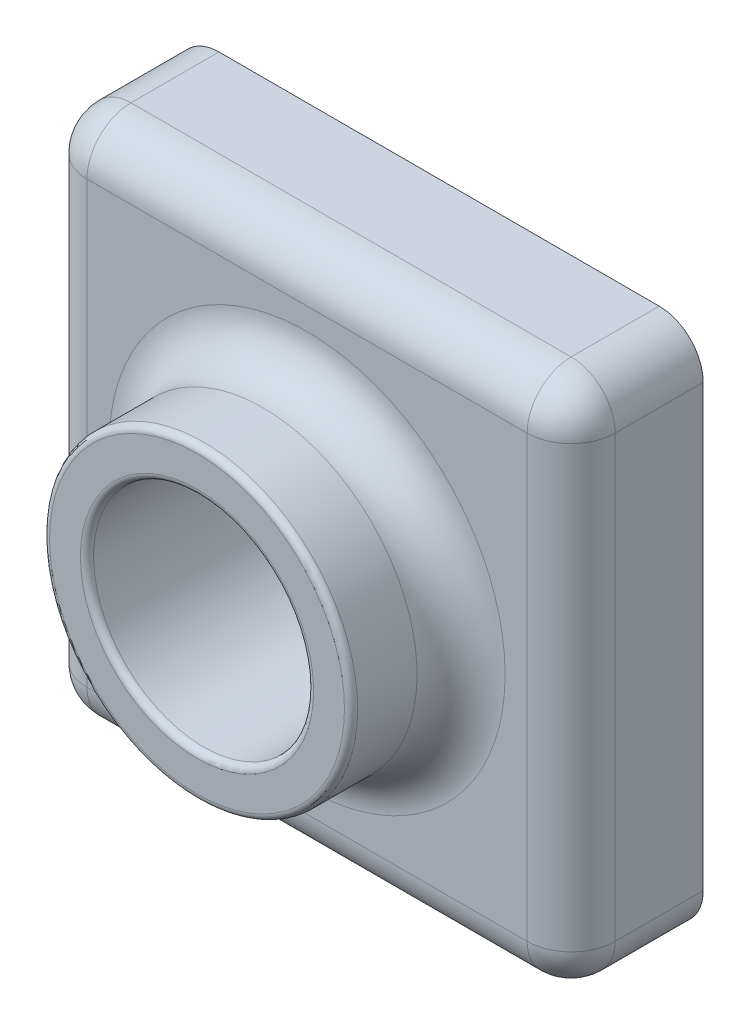
from build123d import *

# Parameters (mm, degrees)
SKETCH1_W           = 120
SKETCH1_H           = 120
BOSS_EXTRUDE1_DEPTH = 30
SKETCH2_R           = 35
BOSS_EXTRUDE2_DEPTH = 25
SKETCH3_R           = 25
CUT_EXTRUDE1_DEPTH  = 179.395627749
FILLET1_R           = 10
FILLET2_R           = 1.5
SHELL1_T            = -2


with BuildPart() as part:
    # Sketch1 → Boss-Extrude1 (new body)
    with BuildSketch(Plane.XY):
        with Locations((-60, -60)):
            Rectangle(SKETCH1_W, SKETCH1_H)
    extrude(amount=BOSS_EXTRUDE1_DEPTH)

    # Sketch2 → Boss-Extrude2 (add)
    with BuildSketch(Plane.XY.offset(30)):
        with Locations((-60, -60)):
            Circle(SKETCH2_R)
    extrude(amount=BOSS_EXTRUDE2_DEPTH)

    # Sketch3 → Cut-Extrude1 (cut, through all)
    with BuildSketch(Plane.XY.offset(55)):
        with Locations((-60, -60)):
            Circle(SKETCH3_R)
    extrude(amount=-CUT_EXTRUDE1_DEPTH, mode=Mode.SUBTRACT)

    # Fillet1
    fillet1_edges = [part.edges().sort_by_distance(p)[0] for p in [
        (-120, -60, 30),
        (-95, -60, 30),
        (-60, -120, 30),
        (0, -60, 30),
        (0, -120, 15),
        (-120, -120, 15),
        (-120, 0, 15),
        (0, 0, 15),
        (-60, 0, 30),
    ]]
    fillet(fillet1_edges, radius=FILLET1_R)

    # Fillet2
    fillet2_edges = [part.edges().sort_by_distance(p)[0] for p in [
        (-95, -60, 55),
        (-85, -60, 55),
    ]]
    fillet(fillet2_edges, radius=FILLET2_R)

    # Shell1
    shell1_openings = [part.faces().sort_by_distance(p)[0] for p in [
        (-60, -1.697056275, 0),
    ]]
    offset(amount=SHELL1_T, openings=shell1_openings, kind=Kind.INTERSECTION)


solid = part.part
